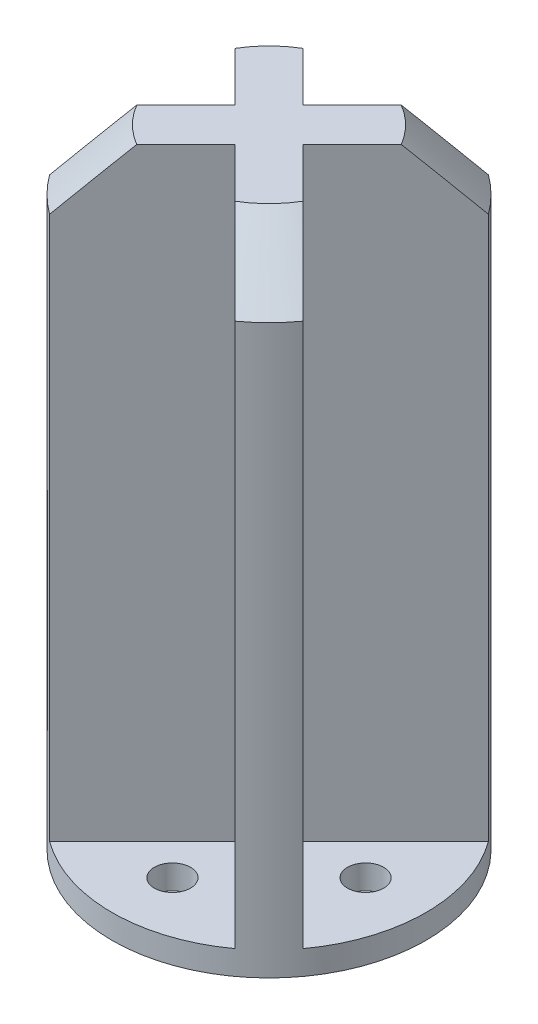
from build123d import *

# Parameters (mm, degrees)
SKETCH1_R           = 13
BOSS_EXTRUDE1_DEPTH = 2
SKETCH2_R           = 1.5
CUT_EXTRUDE1_DEPTH  = 19.493242009
BOSS_EXTRUDE2_DEPTH = 50
CHAMFER1_SIZE       = 5


with BuildPart() as part:
    # Sketch1 → Boss-Extrude1 (new body)
    with BuildSketch(Plane(origin=(0, 0, 0), x_dir=(1, 0, 0), z_dir=(0, 1, 0))):
        with Locations(Location((0, 0, 0), (0, 0, 270))):
            Circle(SKETCH1_R)
    extrude(amount=BOSS_EXTRUDE1_DEPTH)

    # Sketch2 → Cut-Extrude1 (cut, through all)
    with BuildSketch(Plane(origin=(0, 2, 0), x_dir=(1, 0, 0), z_dir=(0, 1, 0))):
        with Locations(Location((-8, 0, 0), (0, 0, 270))):
            Circle(SKETCH2_R)
        with Locations(Location((0, 8, 0), (0, 0, 270))):
            Circle(SKETCH2_R)
        with Locations(Location((8, 0, 0), (0, 0, 270))):
            Circle(SKETCH2_R)
        with Locations(Location((0, -8, 0), (0, 0, 270))):
            Circle(SKETCH2_R)
    extrude(amount=-CUT_EXTRUDE1_DEPTH, mode=Mode.SUBTRACT)

    # Sketch3 → Boss-Extrude2 (add)
    with BuildSketch(Plane(origin=(0, 2, 0), x_dir=(1, 0, 0), z_dir=(0, 1, 0))):
        with BuildLine():
            ThreePointArc((-7.6687375, 10.497164625), (-9.192388155, 9.192388155), (-10.497164625, 7.6687375))
            Line((-10.497164625, 7.6687375), (-2.828427125, 0))
            Line((-2.828427125, 0), (-10.497164625, -7.6687375))
            ThreePointArc((-10.497164625, -7.6687375), (-9.192388155, -9.192388155), (-7.6687375, -10.497164625))
            Line((-7.6687375, -10.497164625), (0, -2.828427125))
            Line((0, -2.828427125), (7.6687375, -10.497164625))
            ThreePointArc((7.6687375, -10.497164625), (9.192388155, -9.192388155), (10.497164625, -7.6687375))
            Line((10.497164625, -7.6687375), (2.828427125, 0))
            Line((2.828427125, 0), (10.497164625, 7.6687375))
            ThreePointArc((10.497164625, 7.6687375), (9.192388155, 9.192388155), (7.6687375, 10.497164625))
            Line((7.6687375, 10.497164625), (0, 2.828427125))
            Line((0, 2.828427125), (-7.6687375, 10.497164625))
        make_face()
    extrude(amount=BOSS_EXTRUDE2_DEPTH)

    # Chamfer1
    chamfer1_edges = [part.edges().sort_by_distance(p)[0] for p in [
        (-9.192388155, 52, 9.192388155),
        (9.192388155, 52, 9.192388155),
        (9.192388155, 52, -9.192388155),
        (-9.192388155, 52, -9.192388155),
    ]]
    chamfer(chamfer1_edges, length=CHAMFER1_SIZE)


solid = part.part
